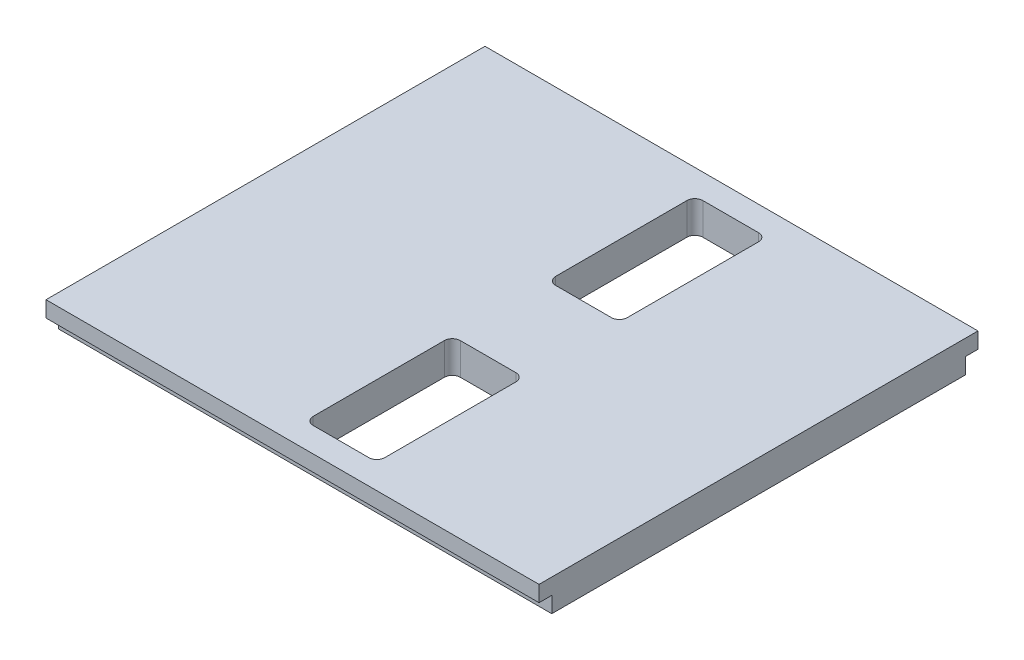
from build123d import *

# Parameters (mm, degrees)
SKETCH1_W           = 175.26
SKETCH1_H           = 12.7
BOSS_EXTRUDE1_DEPTH = 98.425
SKETCH2_W           = 5.08
SKETCH2_H           = 6.35
CUT_EXTRUDE1_DEPTH  = 216.567302483
CUT_EXTRUDE2_DEPTH  = 6.35
SKETCH5_W           = 28.575
SKETCH5_H           = 58.7375
CUT_EXTRUDE4_DEPTH  = 133.392550867
FILLET1_R           = 3.175


with BuildPart() as part:
    # Sketch1 → Boss-Extrude1 (new, symmetric)
    with BuildSketch(Plane(origin=(0, 0, 0), x_dir=(0, 0, -1), z_dir=(1, 0, 0))):
        Rectangle(SKETCH1_W, SKETCH1_H)
    extrude(amount=BOSS_EXTRUDE1_DEPTH, both=True)

    # Sketch2 → Cut-Extrude1 (cut, through all)
    with BuildSketch(Plane(origin=(98.425, 0, 0), x_dir=(0, 0, -1), z_dir=(1, 0, 0))):
        with Locations((-85.09, -3.175)):
            Rectangle(SKETCH2_W, SKETCH2_H)
        with Locations((85.09, -3.175)):
            Rectangle(SKETCH2_W, SKETCH2_H)
    extrude(amount=-CUT_EXTRUDE1_DEPTH, mode=Mode.SUBTRACT)

    # Sketch3 → Cut-Extrude2 (cut)
    with BuildSketch(Plane(origin=(0, -6.35, 0), x_dir=(1, 0, 0), z_dir=(0, 1, 0))):
        with BuildLine():
            Line((28.448, 11.2395), (41.402, 11.2395))
            ThreePointArc((41.402, 11.2395), (44.704, 7.9375), (41.402, 4.6355))
            Line((41.402, 4.6355), (41.402, -4.6355))
            ThreePointArc((41.402, -4.6355), (44.704, -7.9375), (41.402, -11.2395))
            Line((41.402, -11.2395), (28.448, -11.2395))
            ThreePointArc((28.448, -11.2395), (25.146, -7.9375), (28.448, -4.6355))
            Line((28.448, -4.6355), (28.448, 4.6355))
            ThreePointArc((28.448, 4.6355), (25.146, 7.9375), (28.448, 11.2395))
        make_face()
        with BuildLine():
            Line((-22.352, 11.2395), (-9.398, 11.2395))
            ThreePointArc((-9.398, 11.2395), (-6.096, 7.9375), (-9.398, 4.6355))
            Line((-9.398, 4.6355), (-9.398, -4.6355))
            ThreePointArc((-9.398, -4.6355), (-6.096, -7.9375), (-9.398, -11.2395))
            Line((-9.398, -11.2395), (-22.352, -11.2395))
            ThreePointArc((-22.352, -11.2395), (-25.654, -7.9375), (-22.352, -4.6355))
            Line((-22.352, -4.6355), (-22.352, 4.6355))
            ThreePointArc((-22.352, 4.6355), (-25.654, 7.9375), (-22.352, 11.2395))
        make_face()
    extrude(amount=CUT_EXTRUDE2_DEPTH, mode=Mode.SUBTRACT)

    # Sketch5 → Cut-Extrude4 (cut, through all)
    with BuildSketch(Plane(origin=(0, 6.35, 0), x_dir=(1, 0, 0), z_dir=(0, 1, 0))):
        with Locations((9.525, -48.41875)):
            Rectangle(SKETCH5_W, SKETCH5_H)
        with Locations((9.525, 48.41875)):
            Rectangle(SKETCH5_W, SKETCH5_H)
    extrude(amount=-CUT_EXTRUDE4_DEPTH, mode=Mode.SUBTRACT)

    # Fillet1
    fillet1_edges = [part.edges().sort_by_distance(p)[0] for p in [
        (-4.7625, 0, -19.05),
        (-4.7625, 0, -77.7875),
        (23.8125, 0, -77.7875),
        (23.8125, 0, -19.05),
        (-4.7625, 0, 77.7875),
        (-4.7625, 0, 19.05),
        (23.8125, 0, 19.05),
        (23.8125, 0, 77.7875),
    ]]
    fillet(fillet1_edges, radius=FILLET1_R)


solid = part.part
